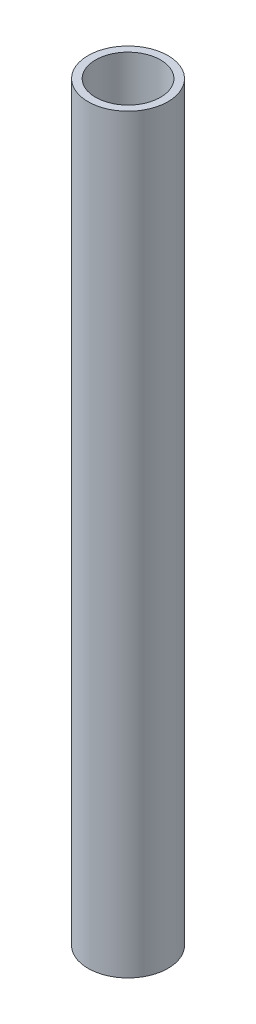
from build123d import *

# Parameters (mm, degrees)
SKETCH_1_R      = 10.65
SKETCH_1_R_2    = 8.65
EXTRUDE_1_DEPTH = 200


with BuildPart() as part:
    # Эскиз1 → Бобышка-Вытянуть1 (new body)
    with BuildSketch(Plane(origin=(0, 0, 0), x_dir=(1, 0, 0), z_dir=(0, 1, 0))):
        with Locations(Location((0, -1.5, 0), (0, 0, 90))):
            Circle(SKETCH_1_R)
        with Locations(Location((0, -1.5, 0), (0, 0, 90))):
            Circle(SKETCH_1_R_2, mode=Mode.SUBTRACT)
    extrude(amount=EXTRUDE_1_DEPTH)


solid = part.part
